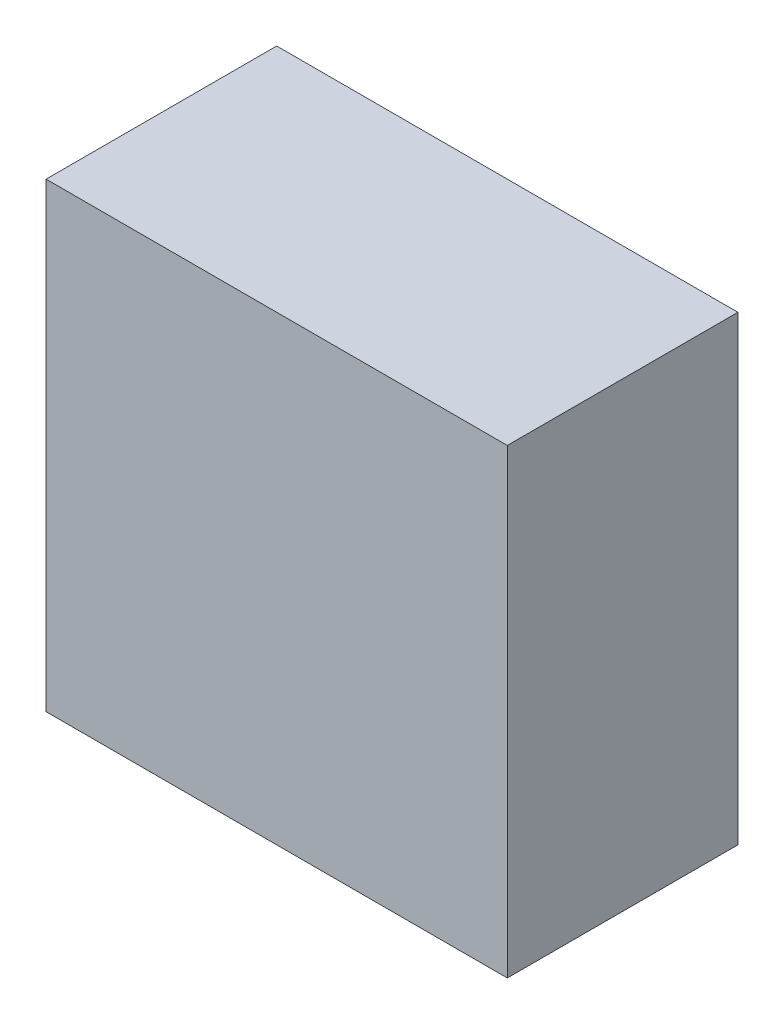
from build123d import *

# Parameters (mm, degrees)
SKETCH1_W           = 300
SKETCH1_H           = 300
BOSS_EXTRUDE1_DEPTH = 150


with BuildPart() as part:
    # Sketch1 → Boss-Extrude1 (new body)
    with BuildSketch(Plane.XY):
        with Locations((150, 150)):
            Rectangle(SKETCH1_W, SKETCH1_H)
    extrude(amount=BOSS_EXTRUDE1_DEPTH)


solid = part.part
